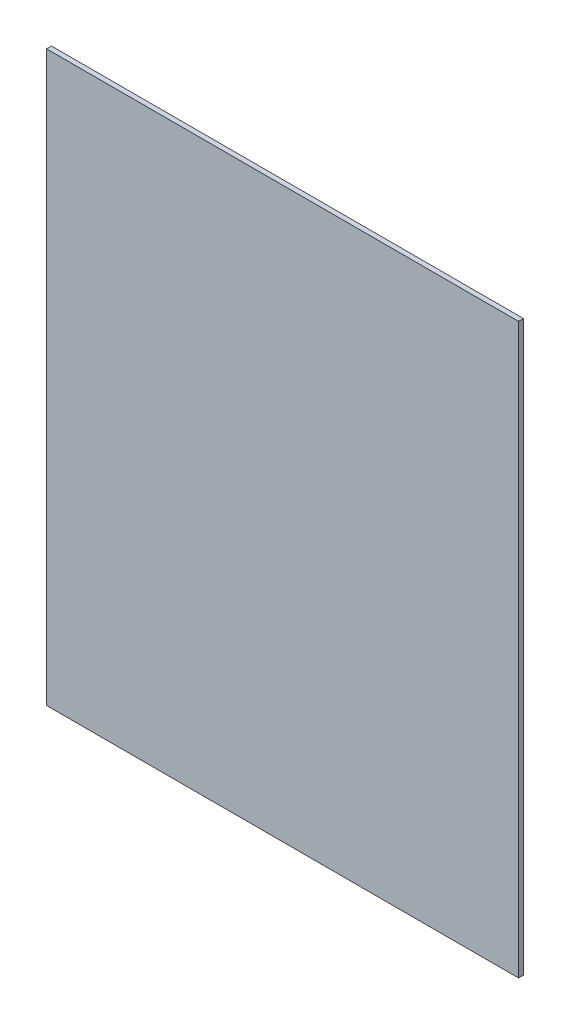
from build123d import *

# Parameters (mm, degrees)
ESQUISSE1_W        = 625
ESQUISSE1_H        = 753
BOSS_EXTRU_1_DEPTH = 6.5


with BuildPart() as part:
    # Esquisse1 → Boss.-Extru.1 (new body)
    with BuildSketch(Plane.XY):
        Rectangle(ESQUISSE1_W, ESQUISSE1_H)
    extrude(amount=BOSS_EXTRU_1_DEPTH)


solid = part.part
